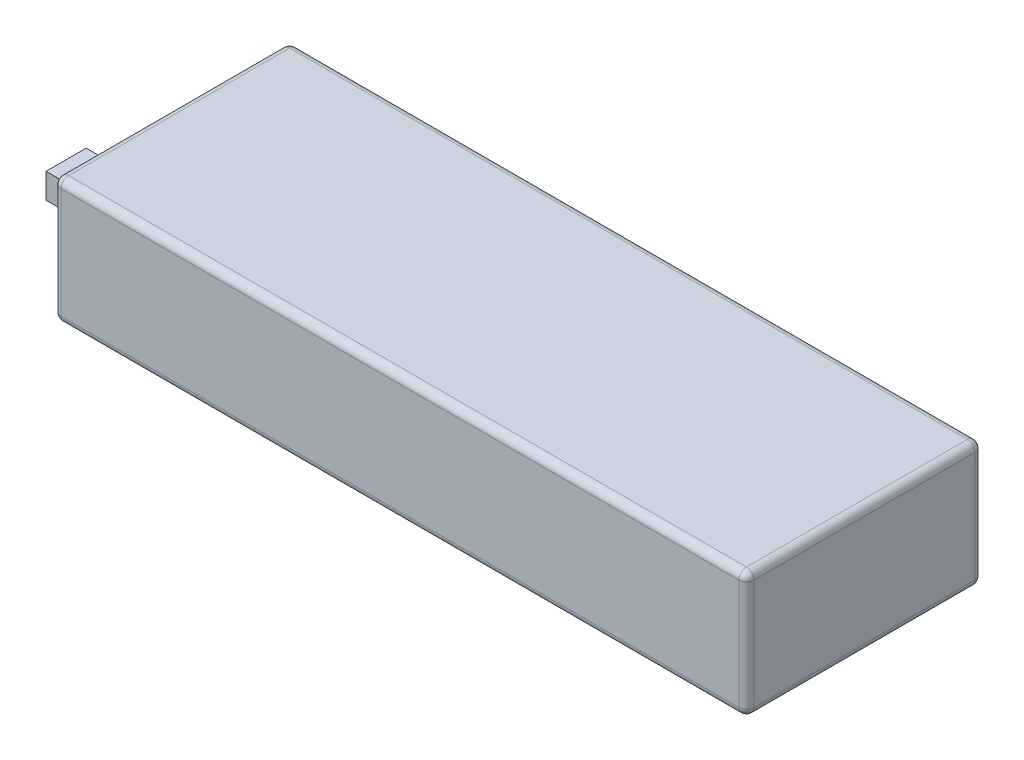
from build123d import *

# Parameters (mm, degrees)
SKETCH1_W           = 138
SKETCH1_H           = 47
BOSS_EXTRUDE1_DEPTH = 12.5
FILLET1_R           = 1.5
SKETCH2_W           = 8
SKETCH2_H           = 5
BOSS_EXTRUDE2_DEPTH = 5


with BuildPart() as part:
    # Sketch1 → Boss-Extrude1 (new, symmetric)
    with BuildSketch(Plane(origin=(0, 0, 0), x_dir=(1, 0, 0), z_dir=(0, 1, 0))):
        Rectangle(SKETCH1_W, SKETCH1_H)
    extrude(amount=BOSS_EXTRUDE1_DEPTH, both=True)

    # Fillet1
    fillet1_edges = [part.edges().sort_by_distance(p)[0] for p in [
        (-69, 12.5, 0),
        (0, 12.5, 23.5),
        (69, 12.5, 0),
        (0, -12.5, 23.5),
        (-69, -12.5, 0),
        (0, -12.5, -23.5),
        (69, -12.5, 0),
        (69, 0, 23.5),
        (-69, 0, 23.5),
        (-69, 0, -23.5),
        (69, 0, -23.5),
        (0, 12.5, -23.5),
    ]]
    fillet(fillet1_edges, radius=FILLET1_R)

    # Sketch2 → Boss-Extrude2 (add)
    with BuildSketch(Plane.ZY.offset(69)):
        with Locations((16, 6.5)):
            Rectangle(SKETCH2_W, SKETCH2_H)
    extrude(amount=BOSS_EXTRUDE2_DEPTH)


solid = part.part
